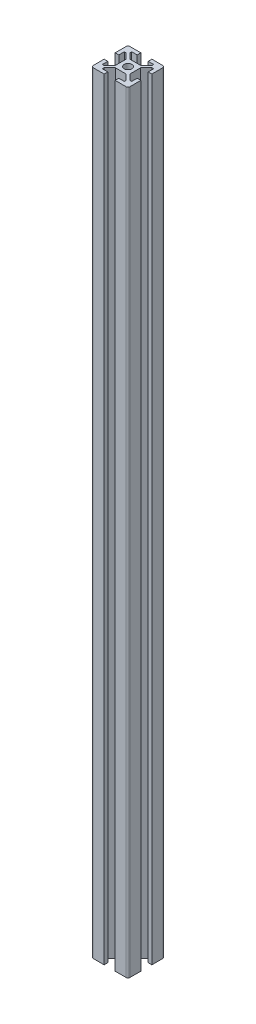
from build123d import *

# Parameters (mm, degrees)
BASE_EXTRUSTION_DEPTH      = 210
BASE_EXTRUSTION_DEPTH_BACK = 210
SKETCH1_R                  = 2.1
CORNERS_R                  = 1


with BuildPart() as part:
    # Sketch1 → Base Extrustion (new, two sides: drawn at the far end of the back side and taken through both)
    with BuildSketch(Plane(origin=(0, 0, 0), x_dir=(1, 0, 0), z_dir=(0, 1, 0)).offset(-BASE_EXTRUSTION_DEPTH_BACK)):
        Polygon((-10, 10), (-3, 10), (-3, 8), (-6, 8), (-6, 7.060660172), (-2.939339828, 4), (2.939339828, 4), (6, 7.060660172), (6, 8), (3, 8), (3, 10), (10, 10), (10, 3), (8, 3), (8, 6), (7.060660172, 6), (4, 2.939339828), (4, -2.939339828), (7.060660172, -6), (8, -6), (8, -3), (10, -3), (10, -10), (3, -10), (3, -8), (6, -8), (6, -7.060660172), (2.939339828, -4), (-2.939339828, -4), (-6, -7.060660172), (-6, -8), (-3, -8), (-3, -10), (-10, -10), (-10, -3), (-8, -3), (-8, -6), (-7.060660172, -6), (-4, -2.939339828), (-4, 2.939339828), (-7.060660172, 6), (-8, 6), (-8, 3), (-10, 3), align=None)
        with Locations(Location((0, 0, 0), (0, 0, 270))):
            Circle(SKETCH1_R, mode=Mode.SUBTRACT)
    extrude(amount=BASE_EXTRUSTION_DEPTH + BASE_EXTRUSTION_DEPTH_BACK)

    # Corners
    corners_edges = [part.edges().sort_by_distance(p)[0] for p in [
        (-10, 0, -10),
        (10, 0, -10),
        (10, 0, 10),
        (-10, 0, 10),
    ]]
    fillet(corners_edges, radius=CORNERS_R)


solid = part.part
